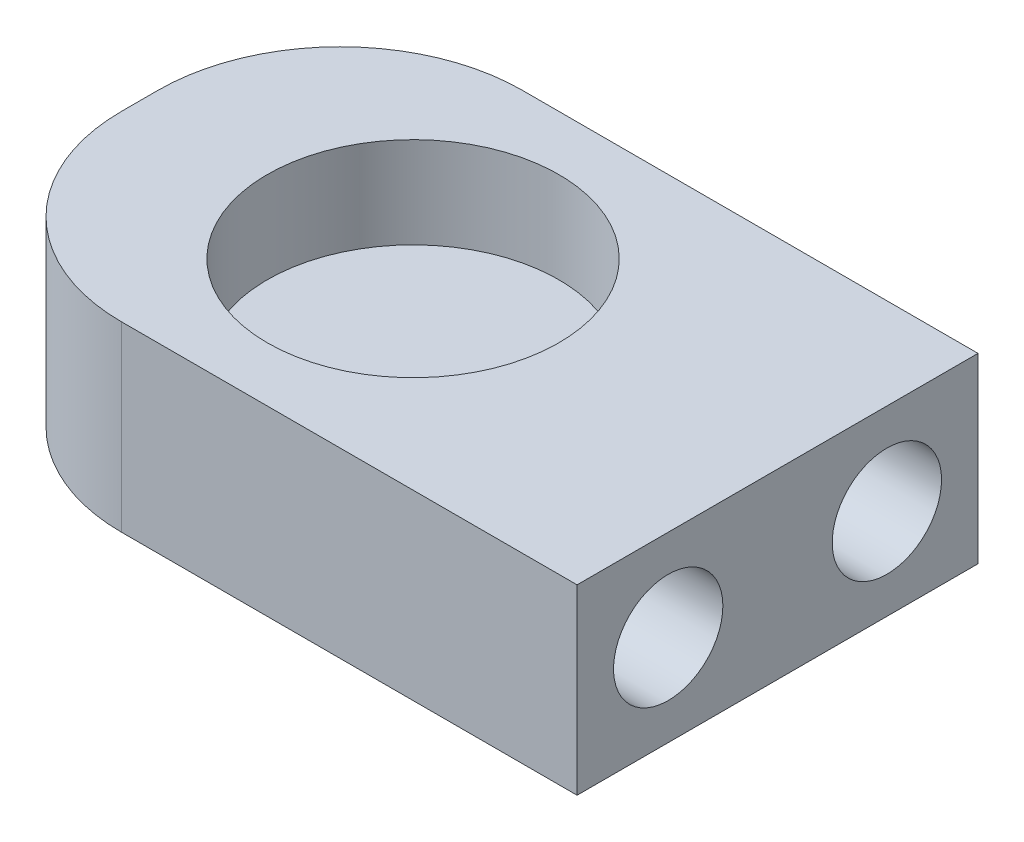
from build123d import *

# Parameters (mm, degrees)
SKETCH1_W           = 35
SKETCH1_H           = 22
BOSS_EXTRUDE1_DEPTH = 10
SKETCH2_R           = 3
CUT_EXTRUDE1_DEPTH  = 10
SKETCH3_R           = 8
CUT_EXTRUDE2_DEPTH  = 5
FILLET1_R           = 10


with BuildPart() as part:
    # Sketch1 → Boss-Extrude1 (new body)
    with BuildSketch(Plane(origin=(0, 0, 0), x_dir=(1, 0, 0), z_dir=(0, 1, 0))):
        Rectangle(SKETCH1_W, SKETCH1_H)
    extrude(amount=BOSS_EXTRUDE1_DEPTH)

    # Sketch2 → Cut-Extrude1 (cut)
    with BuildSketch(Plane(origin=(17.5, 0, 0), x_dir=(0, 0, -1), z_dir=(1, 0, 0))):
        with Locations((6, 5)):
            Circle(SKETCH2_R)
        with Locations((-6, 5)):
            Circle(SKETCH2_R)
    extrude(amount=-CUT_EXTRUDE1_DEPTH, mode=Mode.SUBTRACT)

    # Sketch3 → Cut-Extrude2 (cut)
    with BuildSketch(Plane(origin=(0, 10, 0), x_dir=(1, 0, 0), z_dir=(0, 1, 0))):
        with Locations(Location((-2.5, 0, 0), (0, 0, 270))):
            Circle(SKETCH3_R)
    extrude(amount=-CUT_EXTRUDE2_DEPTH, mode=Mode.SUBTRACT)

    # Fillet1
    fillet1_edges = [part.edges().sort_by_distance(p)[0] for p in [
        (-17.5, 5, 11),
        (-17.5, 5, -11),
    ]]
    fillet(fillet1_edges, radius=FILLET1_R)


solid = part.part
